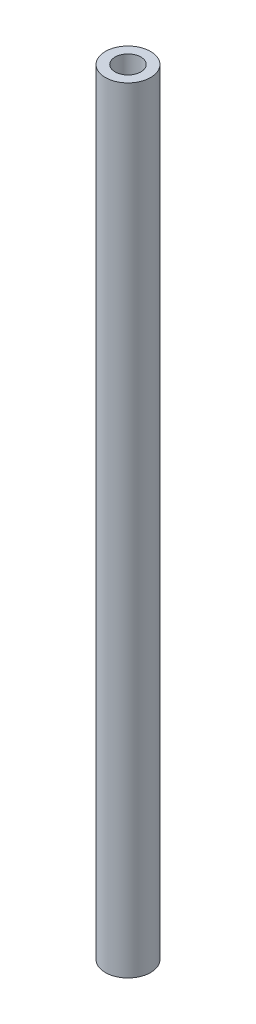
from build123d import *

# Parameters (mm, degrees)
SKETCH_1_R      = 1.75
SKETCH_1_R_2    = 1
EXTRUDE_1_DEPTH = 60


with BuildPart() as part:
    # 草图1 → 凸台-拉伸1 (new body)
    with BuildSketch(Plane(origin=(0, 0, 0), x_dir=(1, 0, 0), z_dir=(0, 1, 0))):
        with Locations(Location((0, 0, 0), (0, 0, 270))):
            Circle(SKETCH_1_R)
        with Locations(Location((0, 0, 0), (0, 0, 270))):
            Circle(SKETCH_1_R_2, mode=Mode.SUBTRACT)
    extrude(amount=EXTRUDE_1_DEPTH)


solid = part.part
